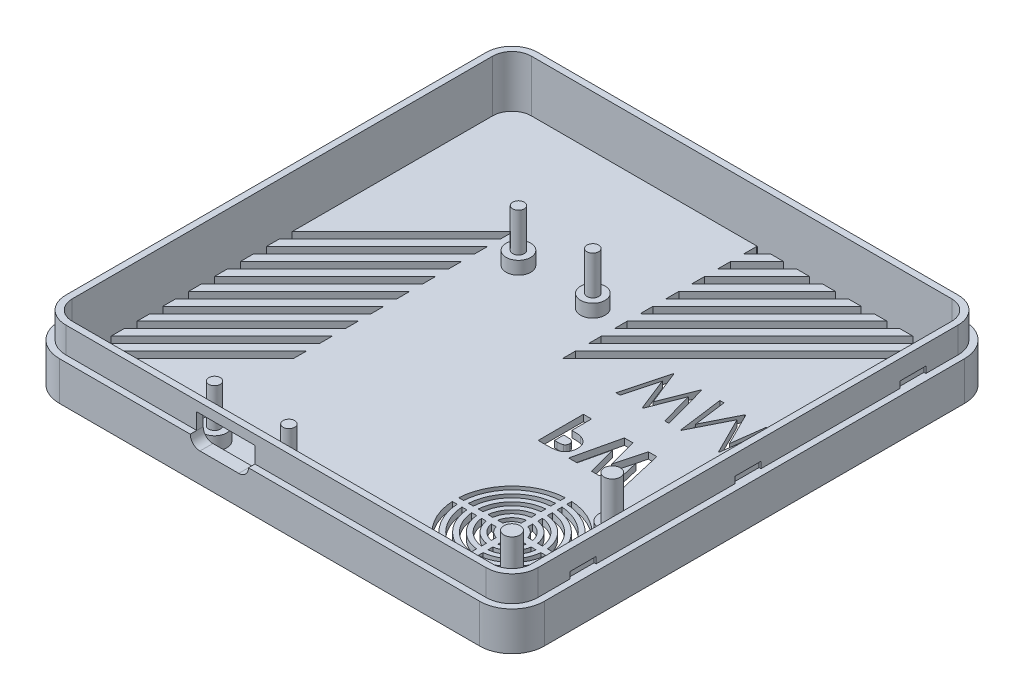
from build123d import *

# Parameters (mm, degrees)
SZKIC1_W                        = 75
SZKIC1_H                        = 75
DODANIE_WYCI_GNI_CIE1_DEPTH     = 10
ZAOKR_GLENIE1_R                 = 5
WYTNIJ_WYCI_GNI_CIE1_DEPTH      = 8
WYTNIJ_WYCI_GNI_CIE2_DEPTH      = 4
SZKIC7_R                        = 1.9
SZKIC7_R_2                      = 0.9
SZKIC7_R_3                      = 1.900523095
SZKIC7_R_4                      = 0.900523095
DODANIE_WYCI_GNI_CIE2_DEPTH     = 2
SZKIC9_R                        = 0.900523095
SZKIC9_R_2                      = 0.9
DODANIE_WYCI_GNI_CIE3_DEPTH     = 8
SZKIC10_R                       = 1.25
DODANIE_WYCI_GNI_CIE4_DEPTH     = 8
SZKIC11_R                       = 2
SZKIC11_R_2                     = 1.25
DODANIE_WYCI_GNI_CIE5_DEPTH     = 1.5
WYTNIJ_WYCI_GNI_CIE5_DEPTH      = 107.367288205
WYTNIJ_WYCI_GNI_CIE5_DEPTH_BACK = 107.367288205
WYTNIJ_WYCI_GNI_CIE6_START      = -1
WYTNIJ_WYCI_GNI_CIE6_DEPTH      = 1
WYTNIJ_WYCI_GNI_CIE9_DEPTH      = 107.447169995
WYTNIJ_WYCI_GNI_CIE9_DEPTH_BACK = 107.447169995
SZKIC20_W                       = 4
SZKIC20_H                       = 1
WYTNIJ_WYCI_GNI_CIE11_DEPTH     = 0.3
SZKIC21_W                       = 4
SZKIC21_H                       = 1
WYTNIJ_WYCI_GNI_CIE12_DEPTH     = 0.3
WYTNIJ_WYCI_GNI_CIE13_DEPTH     = 40
WYTNIJ_WYCI_GNI_CIE16_DEPTH     = 2


with BuildPart() as part:
    # Szkic1 → Dodanie-wyciągnięcie1 (new body)
    with BuildSketch(Plane(origin=(0, 0, 0), x_dir=(1, 0, 0), z_dir=(0, 1, 0))):
        with Locations((37.5, 37.5)):
            Rectangle(SZKIC1_W, SZKIC1_H)
    extrude(amount=DODANIE_WYCI_GNI_CIE1_DEPTH)

    # Zaokrąglenie1
    zaokr_glenie1_edges = [part.edges().sort_by_distance(p)[0] for p in [
        (0, 5, 0),
        (0, 5, -75),
        (75, 5, -75),
        (75, 5, 0),
    ]]
    fillet(zaokr_glenie1_edges, radius=ZAOKR_GLENIE1_R)

    # Szkic4 → Wytnij-wyciągnięcie1 (cut)
    with BuildSketch(Plane(origin=(0, 10, 0), x_dir=(1, 0, 0), z_dir=(0, 1, 0))):
        with BuildLine():
            Line((2, 70), (2, 5))
            ThreePointArc((2, 5), (2.878679656, 2.878679656), (5, 2))
            Line((5, 2), (70, 2))
            ThreePointArc((70, 2), (72.121320344, 2.878679656), (73, 5))
            Line((73, 5), (73, 70))
            ThreePointArc((73, 70), (72.121320344, 72.121320344), (70, 73))
            Line((70, 73), (5, 73))
            ThreePointArc((5, 73), (2.878679656, 72.121320344), (2, 70))
        make_face()
    extrude(amount=-WYTNIJ_WYCI_GNI_CIE1_DEPTH, mode=Mode.SUBTRACT)

    # Szkic6 → Wytnij-wyciągnięcie2 (cut)
    with BuildSketch(Plane(origin=(0, 10, 0), x_dir=(1, 0, 0), z_dir=(0, 1, 0))):
        with BuildLine():
            Line((70, 75), (5, 75))
            ThreePointArc((5, 75), (1.464466094, 73.535533906), (0, 70))
            Line((0, 70), (0, 5))
            ThreePointArc((0, 5), (1.464466094, 1.464466094), (5, 0))
            Line((5, 0), (70, 0))
            ThreePointArc((70, 0), (73.535533906, 1.464466094), (75, 5))
            Line((75, 5), (75, 70))
            ThreePointArc((75, 70), (73.535533906, 73.535533906), (70, 75))
        make_face()
        with BuildLine():
            Line((1, 70), (1, 5))
            ThreePointArc((1, 5), (2.171572875, 2.171572875), (5, 1))
            Line((5, 1), (70, 1))
            ThreePointArc((70, 1), (72.828427125, 2.171572875), (74, 5))
            Line((74, 5), (74, 70))
            ThreePointArc((74, 70), (72.828427125, 72.828427125), (70, 74))
            Line((70, 74), (5, 74))
            ThreePointArc((5, 74), (2.171572875, 72.828427125), (1, 70))
        make_face(mode=Mode.SUBTRACT)
    extrude(amount=-WYTNIJ_WYCI_GNI_CIE2_DEPTH, mode=Mode.SUBTRACT)

    # Szkic7 → Dodanie-wyciągnięcie2 (add)
    # profile 1 of 4: a face of its own
    with BuildSketch(Plane(origin=(0, 2, 0), x_dir=(1, 0, 0), z_dir=(0, 1, 0))):
        with Locations(Location((24, 52, 0), (0, 0, 270))):
            Circle(SZKIC7_R)
        with Locations(Location((24, 52, 0), (0, 0, 270))):
            Circle(SZKIC7_R_2, mode=Mode.SUBTRACT)
    # profile 2 of 4: a face of its own
    with BuildSketch(Plane(origin=(0, 2, 0), x_dir=(1, 0, 0), z_dir=(0, 1, 0))):
        with Locations(Location((35.5, 52, 0), (0, 0, 270))):
            Circle(SZKIC7_R_3)
        with Locations(Location((35.5, 52, 0), (0, 0, 270))):
            Circle(SZKIC7_R_4, mode=Mode.SUBTRACT)
    # profile 3 of 4: a face of its own
    with BuildSketch(Plane(origin=(0, 2, 0), x_dir=(1, 0, 0), z_dir=(0, 1, 0))):
        with Locations(Location((35.5, 5, 0), (0, 0, 270))):
            Circle(SZKIC7_R)
        with Locations(Location((35.5, 5, 0), (0, 0, 270))):
            Circle(SZKIC7_R_2, mode=Mode.SUBTRACT)
    # profile 4 of 4: a face of its own
    with BuildSketch(Plane(origin=(0, 2, 0), x_dir=(1, 0, 0), z_dir=(0, 1, 0))):
        with Locations(Location((24, 5, 0), (0, 0, 270))):
            Circle(SZKIC7_R)
        with Locations(Location((24, 5, 0), (0, 0, 270))):
            Circle(SZKIC7_R_2, mode=Mode.SUBTRACT)
    extrude(amount=DODANIE_WYCI_GNI_CIE2_DEPTH)

    # Szkic9 → Dodanie-wyciągnięcie3 (add)
    with BuildSketch(Plane(origin=(0, 2, 0), x_dir=(1, 0, 0), z_dir=(0, 1, 0))):
        with Locations(Location((35.5, 52, 0), (0, 0, 270))):
            Circle(SZKIC9_R)
        with Locations(Location((35.5, 5, 0), (0, 0, 270))):
            Circle(SZKIC9_R_2)
        with Locations(Location((24, 5, 0), (0, 0, 270))):
            Circle(SZKIC9_R_2)
        with Locations(Location((24, 52, 0), (0, 0, 270))):
            Circle(SZKIC9_R_2)
    extrude(amount=DODANIE_WYCI_GNI_CIE3_DEPTH)

    # Szkic10 → Dodanie-wyciągnięcie4 (add)
    with BuildSketch(Plane(origin=(0, 2, 0), x_dir=(1, 0, 0), z_dir=(0, 1, 0))):
        with Locations(Location((67, 23.5, 0), (0, 0, 270))):
            Circle(SZKIC10_R)
        with Locations(Location((67, 8, 0), (0, 0, 270))):
            Circle(SZKIC10_R)
    extrude(amount=DODANIE_WYCI_GNI_CIE4_DEPTH)

    # Szkic11 → Dodanie-wyciągnięcie5 (add)
    # profile 1 of 2: a face of its own
    with BuildSketch(Plane(origin=(0, 2, 0), x_dir=(1, 0, 0), z_dir=(0, 1, 0))):
        with Locations(Location((67, 23.5, 0), (0, 0, 270))):
            Circle(SZKIC11_R)
        with Locations(Location((67, 23.5, 0), (0, 0, 270))):
            Circle(SZKIC11_R_2, mode=Mode.SUBTRACT)
    # profile 2 of 2: a face of its own
    with BuildSketch(Plane(origin=(0, 2, 0), x_dir=(1, 0, 0), z_dir=(0, 1, 0))):
        with Locations(Location((67, 8, 0), (0, 0, 270))):
            Circle(SZKIC11_R)
        with Locations(Location((67, 8, 0), (0, 0, 270))):
            Circle(SZKIC11_R_2, mode=Mode.SUBTRACT)
    extrude(amount=DODANIE_WYCI_GNI_CIE5_DEPTH)

    # Szkic15 → Wytnij-wyciągnięcie5 (cut, two sides: drawn at the far end of the back side and taken through both)
    with BuildSketch(Plane(origin=(0, 2, 0), x_dir=(1, 0, 0), z_dir=(0, 1, 0)).offset(-WYTNIJ_WYCI_GNI_CIE5_DEPTH_BACK)):
        with BuildLine():
            Line((58.75, 16.25), (58.75, 16.895643924))
            ThreePointArc((58.75, 16.895643924), (58.366116524, 16.633883476), (58.104356076, 16.25))
            Line((58.104356076, 16.25), (58.75, 16.25))
        make_face()
        with BuildLine():
            Line((59.75, 16.895643924), (59.75, 16.25))
            Line((59.75, 16.25), (60.395643924, 16.25))
            ThreePointArc((60.395643924, 16.25), (60.133883476, 16.633883476), (59.75, 16.895643924))
        make_face()
        with BuildLine():
            ThreePointArc((59.75, 14.604356076), (60.133883476, 14.866116524), (60.395643924, 15.25))
            Line((60.395643924, 15.25), (59.75, 15.25))
            Line((59.75, 15.25), (59.75, 14.604356076))
        make_face()
        with BuildLine():
            ThreePointArc((58.104356076, 15.25), (58.366116524, 14.866116524), (58.75, 14.604356076))
            Line((58.75, 14.604356076), (58.75, 15.25))
            Line((58.75, 15.25), (58.104356076, 15.25))
        make_face()
        with BuildLine():
            Line((58.75, 17.686491673), (58.75, 18.454163457))
            ThreePointArc((58.75, 18.454163457), (57.305456352, 17.694543648), (56.545836543, 16.25))
            Line((56.545836543, 16.25), (57.313508327, 16.25))
            ThreePointArc((57.313508327, 16.25), (57.835786438, 17.164213562), (58.75, 17.686491673))
        make_face()
        with BuildLine():
            ThreePointArc((56.545836543, 15.25), (57.305456352, 13.805456352), (58.75, 13.045836543))
            Line((58.75, 13.045836543), (58.75, 13.813508327))
            ThreePointArc((58.75, 13.813508327), (57.835786438, 14.335786438), (57.313508327, 15.25))
            Line((57.313508327, 15.25), (56.545836543, 15.25))
        make_face()
        with BuildLine():
            ThreePointArc((59.75, 13.045836543), (61.194543648, 13.805456352), (61.954163457, 15.25))
            Line((61.954163457, 15.25), (61.186491673, 15.25))
            ThreePointArc((61.186491673, 15.25), (60.664213562, 14.335786438), (59.75, 13.813508327))
            Line((59.75, 13.813508327), (59.75, 13.045836543))
        make_face()
        with BuildLine():
            ThreePointArc((59.75, 17.686491673), (60.664213562, 17.164213562), (61.186491673, 16.25))
            Line((61.186491673, 16.25), (61.954163457, 16.25))
            ThreePointArc((61.954163457, 16.25), (61.194543648, 17.694543648), (59.75, 18.454163457))
            Line((59.75, 18.454163457), (59.75, 17.686491673))
        make_face()
        with BuildLine():
            ThreePointArc((59.75, 19.214101615), (61.724873734, 18.224873734), (62.714101615, 16.25))
            Line((62.714101615, 16.25), (63.470485754, 16.25))
            ThreePointArc((63.470485754, 16.25), (62.25520382, 18.75520382), (59.75, 19.970485754))
            Line((59.75, 19.970485754), (59.75, 19.214101615))
        make_face()
        with BuildLine():
            ThreePointArc((59.75, 20.724937186), (62.785533906, 19.285533906), (64.224937186, 16.25))
            Line((64.224937186, 16.25), (64.978219619, 16.25))
            ThreePointArc((64.978219619, 16.25), (63.315863992, 19.815863992), (59.75, 21.478219619))
            Line((59.75, 21.478219619), (59.75, 20.724937186))
        make_face()
        with BuildLine():
            ThreePointArc((59.75, 22.230740698), (63.846194078, 20.346194078), (65.730740698, 16.25))
            Line((65.730740698, 16.25), (66.482738071, 16.25))
            ThreePointArc((66.482738071, 16.25), (64.376524164, 20.876524164), (59.75, 22.982738071))
            Line((59.75, 22.982738071), (59.75, 22.230740698))
        make_face()
        with BuildLine():
            ThreePointArc((59.75, 23.734359711), (64.906854249, 21.406854249), (67.234359711, 16.25))
            Line((67.234359711, 16.25), (67.985702605, 16.25))
            ThreePointArc((67.985702605, 16.25), (65.437184335, 21.937184335), (59.75, 24.485702605))
            Line((59.75, 24.485702605), (59.75, 23.734359711))
        make_face()
        with BuildLine():
            Line((58.75, 23.734359711), (58.75, 24.485702605))
            ThreePointArc((58.75, 24.485702605), (53.062815665, 21.937184335), (50.514297395, 16.25))
            Line((50.514297395, 16.25), (51.265640289, 16.25))
            ThreePointArc((51.265640289, 16.25), (53.593145751, 21.406854249), (58.75, 23.734359711))
        make_face()
        with BuildLine():
            Line((58.75, 22.230740698), (58.75, 22.982738071))
            ThreePointArc((58.75, 22.982738071), (54.123475836, 20.876524164), (52.017261929, 16.25))
            Line((52.017261929, 16.25), (52.769259302, 16.25))
            ThreePointArc((52.769259302, 16.25), (54.653805922, 20.346194078), (58.75, 22.230740698))
        make_face()
        with BuildLine():
            Line((58.75, 20.724937186), (58.75, 21.478219619))
            ThreePointArc((58.75, 21.478219619), (55.184136008, 19.815863992), (53.521780381, 16.25))
            Line((53.521780381, 16.25), (54.275062814, 16.25))
            ThreePointArc((54.275062814, 16.25), (55.714466094, 19.285533906), (58.75, 20.724937186))
        make_face()
        with BuildLine():
            Line((58.75, 19.214101615), (58.75, 19.970485754))
            ThreePointArc((58.75, 19.970485754), (56.24479618, 18.75520382), (55.029514246, 16.25))
            Line((55.029514246, 16.25), (55.785898385, 16.25))
            ThreePointArc((55.785898385, 16.25), (56.775126266, 18.224873734), (58.75, 19.214101615))
        make_face()
        with BuildLine():
            ThreePointArc((55.029514246, 15.25), (56.24479618, 12.74479618), (58.75, 11.529514246))
            Line((58.75, 11.529514246), (58.75, 12.285898385))
            ThreePointArc((58.75, 12.285898385), (56.775126266, 13.275126266), (55.785898385, 15.25))
            Line((55.785898385, 15.25), (55.029514246, 15.25))
        make_face()
        with BuildLine():
            ThreePointArc((53.521780381, 15.25), (55.184136008, 11.684136008), (58.75, 10.021780381))
            Line((58.75, 10.021780381), (58.75, 10.775062814))
            ThreePointArc((58.75, 10.775062814), (55.714466094, 12.214466094), (54.275062814, 15.25))
            Line((54.275062814, 15.25), (53.521780381, 15.25))
        make_face()
        with BuildLine():
            ThreePointArc((52.017261929, 15.25), (54.123475836, 10.623475836), (58.75, 8.517261929))
            Line((58.75, 8.517261929), (58.75, 9.269259302))
            ThreePointArc((58.75, 9.269259302), (54.653805922, 11.153805922), (52.769259302, 15.25))
            Line((52.769259302, 15.25), (52.017261929, 15.25))
        make_face()
        with BuildLine():
            ThreePointArc((59.75, 10.021780381), (63.315863992, 11.684136008), (64.978219619, 15.25))
            Line((64.978219619, 15.25), (64.224937186, 15.25))
            ThreePointArc((64.224937186, 15.25), (62.785533906, 12.214466094), (59.75, 10.775062814))
            Line((59.75, 10.775062814), (59.75, 10.021780381))
        make_face()
        with BuildLine():
            ThreePointArc((59.75, 8.517261929), (64.376524164, 10.623475836), (66.482738071, 15.25))
            Line((66.482738071, 15.25), (65.730740698, 15.25))
            ThreePointArc((65.730740698, 15.25), (63.846194078, 11.153805922), (59.75, 9.269259302))
            Line((59.75, 9.269259302), (59.75, 8.517261929))
        make_face()
        with BuildLine():
            ThreePointArc((59.75, 7.014297395), (65.437184335, 9.562815665), (67.985702605, 15.25))
            Line((67.985702605, 15.25), (67.234359711, 15.25))
            ThreePointArc((67.234359711, 15.25), (64.906854249, 10.093145751), (59.75, 7.765640289))
            Line((59.75, 7.765640289), (59.75, 7.014297395))
        make_face()
        with BuildLine():
            ThreePointArc((50.514297395, 15.25), (53.062815665, 9.562815665), (58.75, 7.014297395))
            Line((58.75, 7.014297395), (58.75, 7.765640289))
            ThreePointArc((58.75, 7.765640289), (53.593145751, 10.093145751), (51.265640289, 15.25))
            Line((51.265640289, 15.25), (50.514297395, 15.25))
        make_face()
        with BuildLine():
            ThreePointArc((59.75, 11.529514246), (62.25520382, 12.74479618), (63.470485754, 15.25))
            Line((63.470485754, 15.25), (62.714101615, 15.25))
            ThreePointArc((62.714101615, 15.25), (61.724873734, 13.275126266), (59.75, 12.285898385))
            Line((59.75, 12.285898385), (59.75, 11.529514246))
        make_face()
    extrude(amount=WYTNIJ_WYCI_GNI_CIE5_DEPTH + WYTNIJ_WYCI_GNI_CIE5_DEPTH_BACK, mode=Mode.SUBTRACT)

    # Szkic16 → Wytnij-wyciągnięcie6 (cut)
    with BuildSketch(Plane.XZ.offset(WYTNIJ_WYCI_GNI_CIE6_START)):
        with BuildLine():
            Line((70, -1), (5, -1))
            ThreePointArc((5, -1), (2.171572875, -2.171572875), (1, -5))
            Line((1, -5), (1, -70))
            ThreePointArc((1, -70), (2.171572875, -72.828427125), (5, -74))
            Line((5, -74), (70, -74))
            ThreePointArc((70, -74), (72.828427125, -72.828427125), (74, -70))
            Line((74, -70), (74, -5))
            ThreePointArc((74, -5), (72.828427125, -2.171572875), (70, -1))
        make_face()
    extrude(amount=WYTNIJ_WYCI_GNI_CIE6_DEPTH, mode=Mode.SUBTRACT)

    # Szkic18 → Wytnij-wyciągnięcie9 (cut, two sides: drawn at the far end of the back side and taken through both)
    # profile 1 of 5: a face of its own
    with BuildSketch(Plane.XZ.offset(-1).offset(-WYTNIJ_WYCI_GNI_CIE9_DEPTH_BACK)):
        with BuildLine():
            Line((48.981950214, -30.064316004), (50.384193804, -30.064316004))
            add(Edge.make_bspline(
                [(50.384193804, -30.064316004), (50.475814581, -30.064726118), (50.652570265, -30.065517314), (50.907466503, -30.075111619), (51.142620763, -30.092305197), (51.357979019, -30.113553741), (51.553452721, -30.143343373), (51.72928666, -30.177494853), (51.885517326, -30.219101296), (52.023906452, -30.268487566), (52.148106223, -30.32671205), (52.265639264, -30.388725282), (52.373849316, -30.462735886), (52.478198066, -30.540767315), (52.572719718, -30.630273881), (52.663311098, -30.725298791), (52.746135413, -30.829610657), (52.82157644, -30.94194681), (52.890013076, -31.06023176), (52.9498039, -31.184676964), (52.998302868, -31.315479344), (53.038987472, -31.451792757), (53.071665742, -31.593611262), (53.093417438, -31.741807057), (53.108192285, -31.895345381), (53.109495961, -31.999843661), (53.110155342, -32.052697414)],
                knots=[0, 0, 0, 0, 1.698747864, 3.27724071, 4.728299578, 6.070144658, 7.288476769, 8.393259625, 9.389771311, 10.283485332, 11.113357557, 11.931608583, 12.74405601, 13.541433047, 14.344816069, 15.154114104, 15.974336324, 16.810834471, 17.661136416, 18.50621059, 19.367396281, 20.244825668, 21.142564693, 22.063065223, 23.020325768, 24, 24, 24, 24], degree=3))
            add(Edge.make_bspline(
                [(53.110155342, -32.052697414), (53.109201301, -32.111168263), (53.107326491, -32.226070665), (53.088947319, -32.394503491), (53.057549885, -32.55508894), (53.016515081, -32.709181259), (52.959294966, -32.854245287), (52.893923671, -32.993742298), (52.813496244, -33.123761222), (52.72159505, -33.24592844), (52.621228462, -33.36123723), (52.510013781, -33.466358267), (52.390070807, -33.562008158), (52.262093847, -33.649189323), (52.125602437, -33.727725896), (51.980695061, -33.798353289), (51.826382211, -33.85881262), (51.718923385, -33.890432361), (51.664442201, -33.90646344)],
                knots=[0, 0, 0, 0, 1.102006807, 2.165578795, 3.188629044, 4.184801286, 5.166646146, 6.124351954, 7.085497154, 8.042432466, 9.003981491, 9.963833307, 10.922997304, 11.89326795, 12.880200226, 13.889073926, 14.929769137, 16, 16, 16, 16], degree=3))
            add(Edge.make_bspline(
                [(51.664442201, -33.90646344), (51.62855776, -33.915391547), (51.550820503, -33.934732702), (51.422186695, -33.954368829), (51.273949738, -33.972423041), (51.105630283, -33.98793845), (50.917131292, -33.998485313), (50.70863528, -34.006721943), (50.48004776, -34.012710825), (50.321097038, -34.012923337), (50.238360471, -34.013033953)],
                knots=[0, 0, 0, 0, 0.618981996, 1.340914327, 2.176866532, 3.120127938, 4.170906482, 5.338178032, 6.614476169, 8, 8, 8, 8], degree=3))
            Line((50.238360471, -34.013033953), (50.238360471, -37.064316004))
            Line((50.238360471, -37.064316004), (48.981950214, -37.064316004))
            Line((48.981950214, -37.064316004), (48.981950214, -30.064316004))
        make_face()
        with BuildLine():
            Line((50.238360471, -32.756623696), (50.682871689, -32.756623696))
            add(Edge.make_bspline(
                [(50.682871689, -32.756623696), (50.763757522, -32.756110817), (50.912588659, -32.755167112), (51.115839433, -32.741520591), (51.279175666, -32.720679595), (51.408214322, -32.690788789), (51.510102564, -32.645425531), (51.597974793, -32.592948785), (51.673345048, -32.52659338), (51.738604595, -32.450770976), (51.790777636, -32.363647233), (51.826956922, -32.266640793), (51.850458275, -32.161789865), (51.852628844, -32.088820559), (51.853745086, -32.05129517)],
                knots=[0, 0, 0, 0, 1.8619151, 3.425951444, 4.686033666, 5.651700536, 6.461346321, 7.243864085, 7.999046032, 8.762387399, 9.539336099, 10.322741239, 11.137448474, 12, 12, 12, 12], degree=3))
            add(Edge.make_bspline(
                [(51.853745086, -32.05129517), (51.852640326, -32.018509727), (51.850496826, -31.954898085), (51.83475009, -31.863090707), (51.809654322, -31.777507291), (51.773291519, -31.699041644), (51.726283026, -31.627827091), (51.668970159, -31.563891685), (51.602088356, -31.505866196), (51.550451694, -31.475152419), (51.524217842, -31.459548376)],
                knots=[0, 0, 0, 0, 1.102301479, 2.1387299, 3.123554645, 4.094223062, 5.036071848, 5.982632524, 6.975082478, 8, 8, 8, 8], degree=3))
            add(Edge.make_bspline(
                [(51.524217842, -31.459548376), (51.501996255, -31.448310282), (51.454948602, -31.424516934), (51.374821887, -31.396855428), (51.282356882, -31.373519901), (51.176929343, -31.354151638), (51.058959851, -31.339119855), (50.928469454, -31.327624302), (50.785266123, -31.323001492), (50.685676775, -31.321505589), (50.633793163, -31.32072626)],
                knots=[0, 0, 0, 0, 0.656809284, 1.390599849, 2.23162475, 3.173112763, 4.218524733, 5.370385145, 6.63003504, 8, 8, 8, 8], degree=3))
            Line((50.633793163, -31.32072626), (50.238360471, -31.32072626))
            Line((50.238360471, -31.32072626), (50.238360471, -32.756623696))
        make_face(mode=Mode.SUBTRACT)
    # profile 2 of 5: a face of its own
    with BuildSketch(Plane.XZ.offset(-1).offset(-WYTNIJ_WYCI_GNI_CIE9_DEPTH_BACK)):
        Polygon((53.693488676, -30.064316004), (54.990563996, -30.064316004), (56.026822009, -34.533266324), (57.21452233, -30.064316004), (58.435876496, -30.064316004), (59.616565599, -34.533266324), (60.650019124, -30.064316004), (61.949898932, -30.064316004), (60.330307586, -37.064316004), (59.017807586, -37.064316004), (57.821693804, -32.53927594), (56.618568804, -37.064316004), (55.315884509, -37.064316004), align=None)
    # profile 3 of 5: a face of its own
    with BuildSketch(Plane.XZ.offset(-1).offset(-WYTNIJ_WYCI_GNI_CIE9_DEPTH_BACK)):
        Polygon((48.622975855, -42.461751901), (49.272214637, -42.461751901), (50.642206624, -47.595365683), (52.67966656, -42.461751901), (52.770812394, -42.461751901), (54.770411753, -47.560309594), (56.147414958, -42.461751901), (56.789642522, -42.461751901), (54.90222265, -49.461751901), (54.81247906, -49.461751901), (52.706309189, -44.107985876), (50.574898932, -49.461751901), (50.485155342, -49.461751901), align=None)
    # profile 4 of 5: a face of its own
    with BuildSketch(Plane.XZ.offset(-1).offset(-WYTNIJ_WYCI_GNI_CIE9_DEPTH_BACK)):
        Polygon((57.687078419, -49.461751901), (58.611156945, -42.461751901), (58.700900535, -42.461751901), (61.590924573, -48.205341645), (64.473937394, -42.461751901), (64.565083227, -42.461751901), (65.494770727, -49.461751901), (64.863761112, -49.461751901), (64.193488676, -44.424892927), (61.666645727, -49.461751901), (61.525019124, -49.461751901), (58.988360471, -44.413674978), (58.319490278, -49.461751901), align=None)
    # profile 5 of 5: a face of its own
    with BuildSketch(Plane.XZ.offset(-1).offset(-WYTNIJ_WYCI_GNI_CIE9_DEPTH_BACK)):
        Polygon((66.122975855, -43.179700619), (66.122975855, -42.461751901), (69.802463035, -42.461751901), (69.802463035, -43.179700619), (68.276822009, -43.179700619), (68.276822009, -49.461751901), (67.648616881, -49.461751901), (67.648616881, -43.179700619), align=None)
    extrude(amount=WYTNIJ_WYCI_GNI_CIE9_DEPTH + WYTNIJ_WYCI_GNI_CIE9_DEPTH_BACK, mode=Mode.SUBTRACT)


with BuildPart() as wytnij_wyci_gni_cie9_piece_1:
    # of the separate pieces the step leaves, piece 1, a body of its own (wytnij_wyci_gni_cie9_pieces)
    add(part.part.solids().sort_by_distance((0, 0, -5))[0])

    # Szkic20 → Wytnij-wyciągnięcie11 (cut)
    with BuildSketch(Plane.ZY.offset(-1)):
        with Locations((-63, 6.5)):
            Rectangle(SZKIC20_W, SZKIC20_H)
        with Locations((-12, 6.5)):
            Rectangle(SZKIC20_W, SZKIC20_H)
        with Locations((-37.5, 6.5)):
            Rectangle(SZKIC20_W, SZKIC20_H)
    extrude(amount=-WYTNIJ_WYCI_GNI_CIE11_DEPTH, mode=Mode.SUBTRACT)

    # Szkic21 → Wytnij-wyciągnięcie12 (cut)
    with BuildSketch(Plane(origin=(74, 0, 0), x_dir=(0, 0, -1), z_dir=(1, 0, 0))):
        with Locations((12, 6.5)):
            Rectangle(SZKIC21_W, SZKIC21_H)
        with Locations((63, 6.5)):
            Rectangle(SZKIC21_W, SZKIC21_H)
        with Locations((37.5, 6.5)):
            Rectangle(SZKIC21_W, SZKIC21_H)
    extrude(amount=-WYTNIJ_WYCI_GNI_CIE12_DEPTH, mode=Mode.SUBTRACT)

    # Szkic19 → Wytnij-wyciągnięcie13 (cut)
    with BuildSketch(Plane(origin=(0, 0, -2), x_dir=(-1, 0, 0), z_dir=(0, 0, -1))):
        with BuildLine():
            Line((-32.75, 4.5), (-26.75, 4.5))
            ThreePointArc((-26.75, 4.5), (-25.689339828, 4.939339828), (-25.25, 6))
            Line((-25.25, 6), (-25.25, 8.5))
            Line((-25.25, 8.5), (-34.25, 8.5))
            Line((-34.25, 8.5), (-34.25, 6))
            ThreePointArc((-34.25, 6), (-33.810660172, 4.939339828), (-32.75, 4.5))
        make_face()
    extrude(amount=-WYTNIJ_WYCI_GNI_CIE13_DEPTH, mode=Mode.SUBTRACT)

    # Szkic14 → Wytnij-wyciągnięcie16 (cut)
    with BuildSketch(Plane(origin=(0, 2, 0), x_dir=(1, 0, 0), z_dir=(0, 1, 0))):
        Polygon((2, 37), (19.102817133, 54.102817133), (19.102817133, 55), (19.102817133, 56.102817133), (2, 39), align=None)
        Polygon((2, 33), (19.102817133, 50.102817133), (19.102817133, 52.102817133), (2, 35), align=None)
        Polygon((2, 29), (19.102817133, 46.102817133), (19.102817133, 48.102817133), (2, 31), align=None)
        Polygon((2, 25), (19.102817133, 42.102817133), (19.102817133, 44.102817133), (2, 27), align=None)
        Polygon((19.102817133, 38.102817133), (19.102817133, 40.102817133), (2, 23), (2, 21), align=None)
        Polygon((19.102817133, 34.102817133), (19.102817133, 36.102817133), (2, 19), (2, 17), align=None)
        Polygon((19.102817133, 30.102817133), (19.102817133, 32.102817133), (2, 15), (2, 13), align=None)
        Polygon((19.102817133, 26.102817133), (19.102817133, 28.102817133), (2, 11), (2, 9), align=None)
        Polygon((19.102817133, 22.102817133), (19.102817133, 24.102817133), (2, 7), (2, 5), align=None)
        Polygon((39.899048849, 70.899048849), (42, 73), (40, 73), (39.899048849, 72.899048849), align=None)
        Polygon((39.899048849, 66.899048849), (46, 73), (44, 73), (39.899048849, 68.899048849), align=None)
        Polygon((39.899048849, 62.899048849), (50, 73), (48, 73), (39.899048849, 64.899048849), align=None)
        Polygon((54, 73), (52, 73), (39.899048849, 60.899048849), (39.899048849, 58.899048849), align=None)
        Polygon((58, 73), (56, 73), (39.899048849, 56.899048849), (39.899048849, 55), (40, 55), align=None)
        Polygon((62, 73), (60, 73), (39.899048849, 52.899048849), (39.899048849, 50.899048849), align=None)
        Polygon((66, 73), (64, 73), (39.899048849, 48.899048849), (39.899048849, 46.899048849), align=None)
        Polygon((70, 73), (68, 73), (39.899048849, 44.899048849), (39.899048849, 42.899048849), align=None)
    extrude(amount=-WYTNIJ_WYCI_GNI_CIE16_DEPTH, mode=Mode.SUBTRACT)


with BuildPart() as wytnij_wyci_gni_cie9_piece_2:
    # of the separate pieces the step leaves, piece 2, a body of its own (wytnij_wyci_gni_cie9_pieces)
    add(part.part.solids().sort_by_distance((51.853745086, 1, -32.05129517))[0])


solid = Compound([wytnij_wyci_gni_cie9_piece_1.part, wytnij_wyci_gni_cie9_piece_2.part])
